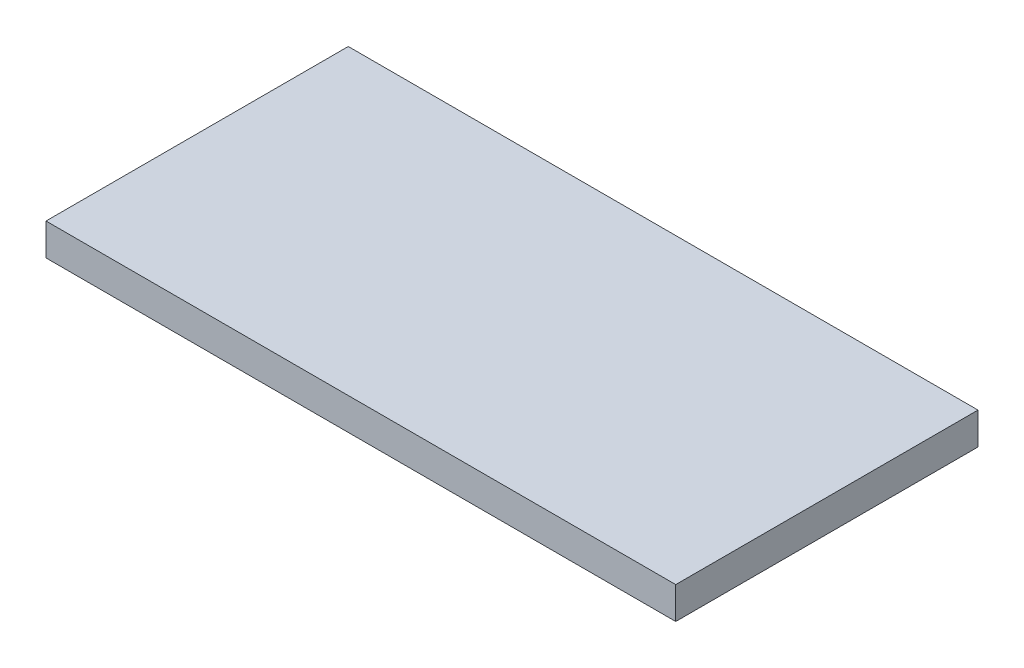
from build123d import *

# Parameters (mm, degrees)
SKETCH2_W           = 375
SKETCH2_H           = 180
BOSS_EXTRUDE1_DEPTH = 19.05


with BuildPart() as part:
    # Sketch2 → Boss-Extrude1 (new body)
    with BuildSketch(Plane(origin=(0, 0, 0), x_dir=(1, 0, 0), z_dir=(0, 1, 0))):
        Rectangle(SKETCH2_W, SKETCH2_H)
    extrude(amount=BOSS_EXTRUDE1_DEPTH)


solid = part.part
